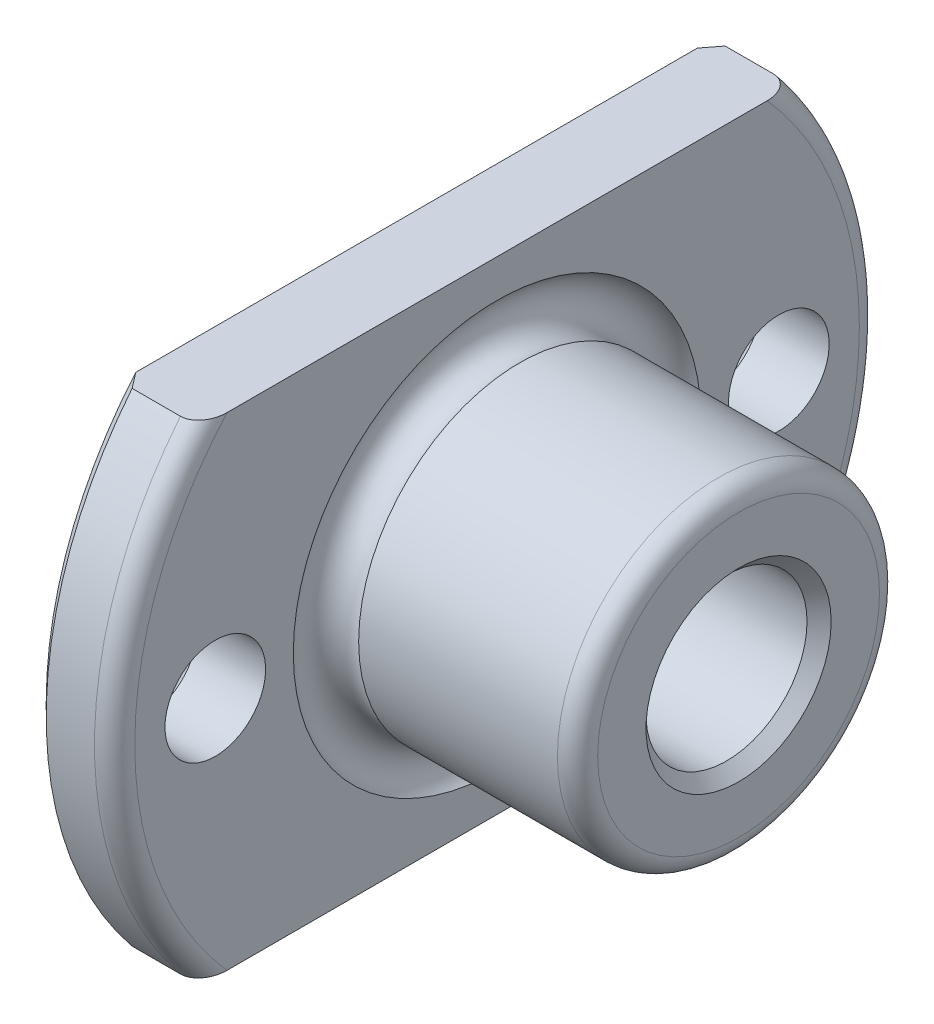
from build123d import *

# Parameters (mm, degrees)
TROU_TARAUD_M3X0_51_AT_2_COUNT = 2
TROU_TARAUD_M3X0_51_AT_2_PITCH = 14
CHANFREIN1_SIZE                = 0.3
ESQUISSE7_W                    = 26.326678726
ESQUISSE7_H                    = 21.946612952
ESQUISSE7_W_2                  = 20
ESQUISSE7_H_2                  = 12
ENL_V_MAT_EXTRU_2_DEPTH        = 10


with BuildPart() as part:
    # Esquisse1 → Révolution1 (revolve)
    with BuildSketch(Plane.XY, mode=Mode.PRIVATE) as r_volution1_sk:
        with BuildLine():
            Line((0, 2), (8, 2))
            Line((8, 2), (8, 3.5))
            ThreePointArc((8, 3.5), (7.853553391, 3.853553391), (7.5, 4))
            Line((7.5, 4), (2.561460361, 4))
            ThreePointArc((2.561460361, 4), (1.75, 4.25), (2, 5.061460361))
            Line((2, 5.061460361), (2, 9))
            ThreePointArc((2, 9), (1.853553391, 9.353553391), (1.5, 9.5))
            Line((1.5, 9.5), (0, 9.5))
            Line((0, 9.5), (0, 2))
        make_face()
    revolve(r_volution1_sk.sketch.rotate(Axis((0, 0, 0), (1, 0, 0)), 90), axis=Axis((0, 0, 0), (1, 0, 0)))

    # Esquisse2 → Trou taraudé M3x0.51 (revolve, cut)
    with BuildSketch(Plane(origin=(0, 0, -7), x_dir=(0, 0, 1), z_dir=(0, 1, 0))):
        Polygon((0, 0), (0, 8), (1.6, 8), (1.25, 7.65), (1.25, 0), align=None)
    trou_taraud_m3x0_51 = revolve(axis=Axis((-6.35, 0, -7), (1, 0, 0)), mode=Mode.SUBTRACT)

    # Trou taraudé M3x0.51 at 2: Trou taraudé M3x0.51 ×2
    with Locations(*[(0, 0, i * TROU_TARAUD_M3X0_51_AT_2_PITCH) for i in range(1, TROU_TARAUD_M3X0_51_AT_2_COUNT)]):
        add(trou_taraud_m3x0_51, mode=Mode.SUBTRACT)

    # Chanfrein1
    chanfrein1_edges = [part.edges().sort_by_distance(p)[0] for p in [
        (0, 0, -2),
        (0, 0, 5.75),
        (0, 0, -8.25),
        (0, 0, -9.5),
        (8, 0, -2),
    ]]
    chamfer(chanfrein1_edges, length=CHANFREIN1_SIZE)

    # Esquisse7 → Enlèv. mat.-Extru.2 (cut)
    with BuildSketch(Plane(origin=(0, 0, 0), x_dir=(0, 0, -1), z_dir=(1, 0, 0))):
        Rectangle(ESQUISSE7_W, ESQUISSE7_H)
        Rectangle(ESQUISSE7_W_2, ESQUISSE7_H_2, mode=Mode.SUBTRACT)
    extrude(amount=ENL_V_MAT_EXTRU_2_DEPTH, mode=Mode.SUBTRACT)


solid = part.part
